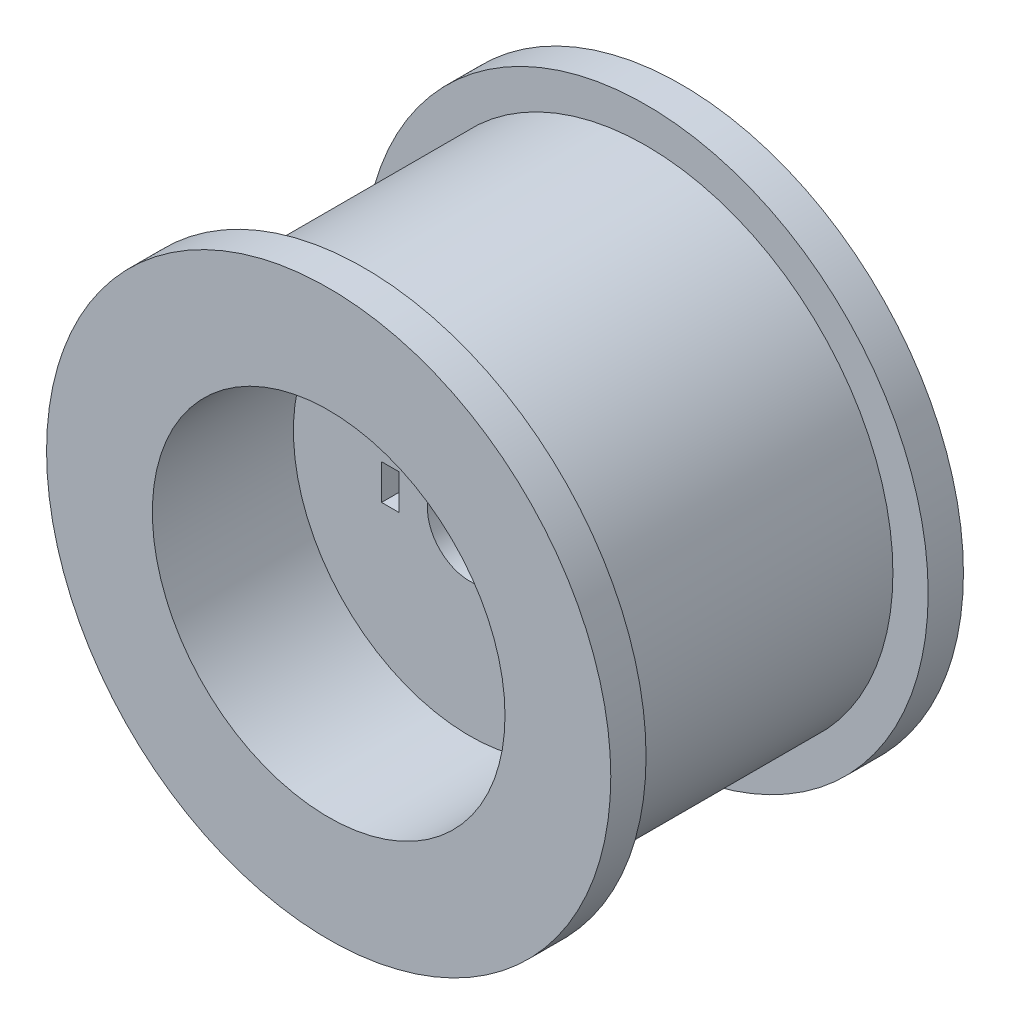
from build123d import *

# Parameters (mm, degrees)
SKETCH1_R           = 35
BOSS_EXTRUDE1_DEPTH = 40
SKETCH2_R           = 40
BOSS_EXTRUDE2_DEPTH = 5
BOSS_EXTRUDE3_START = 5
SKETCH3_R           = 40
BOSS_EXTRUDE3_DEPTH = 5
SKETCH4_R           = 25
CUT_EXTRUDE1_DEPTH  = 20
CUT_EXTRUDE2_START  = -20
SKETCH5_R           = 25
CUT_EXTRUDE2_DEPTH  = 20
SKETCH6_R           = 6
CUT_EXTRUDE3_DEPTH  = 20
CUT_EXTRUDE4_DEPTH  = 10


with BuildPart() as part:
    # Sketch1 → Boss-Extrude1 (new body)
    with BuildSketch(Plane.XY):
        Circle(SKETCH1_R)
    extrude(amount=BOSS_EXTRUDE1_DEPTH)

    # Sketch2 → Boss-Extrude2 (add)
    with BuildSketch(Plane.XY.offset(40)):
        Circle(SKETCH2_R)
    extrude(amount=BOSS_EXTRUDE2_DEPTH)

    # Sketch3 → Boss-Extrude3 (add)
    with BuildSketch(Plane(origin=(0, 0, 0), x_dir=(-1, 0, 0), z_dir=(0, 0, -1)).offset(BOSS_EXTRUDE3_START)):
        with Locations(Location((0, 0, 0), (0, 0, 180))):
            Circle(SKETCH3_R)
    extrude(amount=-BOSS_EXTRUDE3_DEPTH)

    # Sketch4 → Cut-Extrude1 (cut)
    with BuildSketch(Plane.XY.offset(45)):
        Circle(SKETCH4_R)
    extrude(amount=-CUT_EXTRUDE1_DEPTH, mode=Mode.SUBTRACT)

    # Sketch5 → Cut-Extrude2 (cut)
    with BuildSketch(Plane(origin=(0, 0, -5), x_dir=(-1, 0, 0), z_dir=(0, 0, -1)).offset(CUT_EXTRUDE2_START)):
        with Locations(Location((0, 0, 0), (0, 0, 180))):
            Circle(SKETCH5_R)
    extrude(amount=CUT_EXTRUDE2_DEPTH, mode=Mode.SUBTRACT)

    # Sketch6 → Cut-Extrude3 (cut)
    with BuildSketch(Plane.XY.offset(25)):
        Circle(SKETCH6_R)
    extrude(amount=-CUT_EXTRUDE3_DEPTH, mode=Mode.SUBTRACT)

    # Sketch7 → Cut-Extrude4 (cut)
    with BuildSketch(Plane.XY.offset(25)):
        Polygon((-10, -0.07309958), (-10, -2.57309958), (-12.5, -2.57309958), (-12.5, -0.07309958), (-12.5, 2.42690042), (-10, 2.42690042), align=None)
    extrude(amount=-CUT_EXTRUDE4_DEPTH, mode=Mode.SUBTRACT)


solid = part.part
